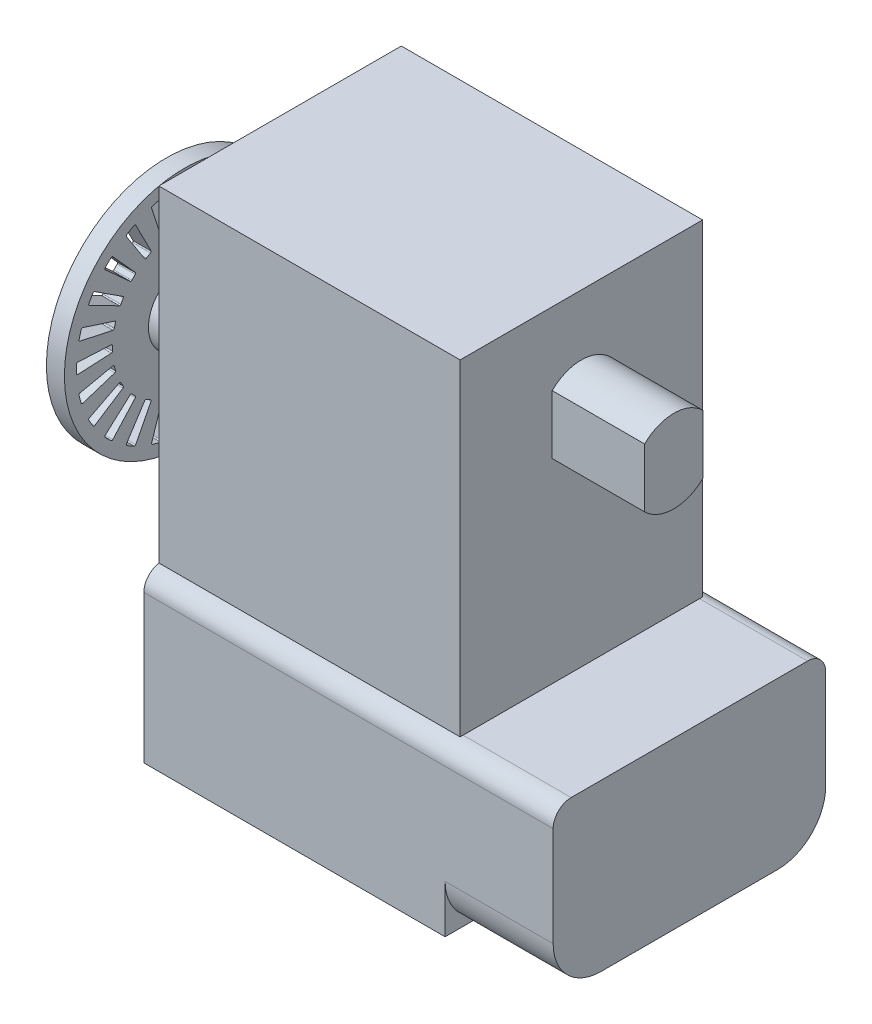
from build123d import *

# Parameters (mm, degrees)
ESQUISSE1_W                  = 25.1
ESQUISSE1_H                  = 27.2
EXTRUSION1_DEPTH             = 20.2
EXTRUSION2_DEPTH             = 25.1
EXTRUSION3_DEPTH             = 9
EXTRUSION4_DEPTH             = 7.7
ESQUISSE6_R                  = 1.25
EXTRUSION5_DEPTH             = 10
ENL_V_MAT_EXTRU_1_REACH      = 57.662
R_P_TITION_CIRCULAIRE1_COUNT = 24


with BuildPart() as part:
    # Esquisse1 → Extrusion1 (new body)
    with BuildSketch(Plane.XY):
        with Locations((12.55, 13.6)):
            Rectangle(ESQUISSE1_W, ESQUISSE1_H)
    extrude(amount=EXTRUSION1_DEPTH)

    # Esquisse2 → Extrusion2 (add)
    with BuildSketch(Plane.ZY):
        with BuildLine():
            Line((0.25, 0), (19.95, 0))
            ThreePointArc((19.95, 0), (21.010660172, -0.439339828), (21.45, -1.5))
            Line((21.45, -1.5), (21.45, -13.8))
            Line((21.45, -13.8), (-1.25, -13.8))
            Line((-1.25, -13.8), (-1.25, -1.5))
            ThreePointArc((-1.25, -1.5), (-0.810660172, -0.439339828), (0.25, 0))
        make_face()
    extrude(amount=-EXTRUSION2_DEPTH)

    # Esquisse4 → Extrusion3 (add)
    with BuildSketch(Plane(origin=(25.1, 0, 0), x_dir=(0, 0, -1), z_dir=(1, 0, 0))):
        with BuildLine():
            Line((1.25, -9.8), (1.25, -1.5))
            ThreePointArc((1.25, -1.5), (0.810660172, -0.439339828), (-0.25, 0))
            Line((-0.25, 0), (-19.95, 0))
            ThreePointArc((-19.95, 0), (-21.010660172, -0.439339828), (-21.45, -1.5))
            Line((-21.45, -1.5), (-21.45, -9.8))
            ThreePointArc((-21.45, -9.8), (-20.278427125, -12.628427125), (-17.45, -13.8))
            Line((-17.45, -13.8), (-2.75, -13.8))
            ThreePointArc((-2.75, -13.8), (0.078427125, -12.628427125), (1.25, -9.8))
        make_face()
    extrude(amount=EXTRUSION3_DEPTH)

    # Esquisse5 → Extrusion4 (add)
    with BuildSketch(Plane(origin=(25.1, 0, 0), x_dir=(0, 0, -1), z_dir=(1, 0, 0))):
        with BuildLine():
            Line((-12.52899156, 21.15), (-12.52899156, 16.25))
            ThreePointArc((-12.52899156, 16.25), (-10.1, 15.25), (-7.67100844, 16.25))
            Line((-7.67100844, 16.25), (-7.67100844, 21.15))
            ThreePointArc((-7.67100844, 21.15), (-10.1, 22.15), (-12.52899156, 21.15))
        make_face()
    extrude(amount=EXTRUSION4_DEPTH)

    # Esquisse6 → Extrusion5 (add)
    with BuildSketch(Plane.ZY):
        with Locations(Location((10.1, 9.45, 0), (0, 0, 180))):
            Circle(ESQUISSE6_R)
    extrude(amount=EXTRUSION5_DEPTH)

    # Esquisse7 → Révolution1 (revolve)
    with BuildSketch(Plane.XY.offset(10.1), mode=Mode.PRIVATE) as r_volution1_sk:
        Polygon((-9.47, 10.7), (-9.47, 19.45), (-7.97, 19.45), (-7.97, 12.45), (-3.47, 12.45), (-3.47, 10.7), align=None)
    revolve(r_volution1_sk.sketch.rotate(Axis((0, 9.45, 10.1), (-1, 0, 0)), 90), axis=Axis((0, 9.45, 10.1), (-1, 0, 0)))

    # Esquisse8 → Enlèv. mat.-Extru.1 (cut, up to next)
    with BuildSketch(Plane.ZY.offset(9.47), mode=Mode.PRIVATE) as enl_v_mat_extru_1_sk1:
        with BuildLine():
            Line((9.796978978, 15.541549664), (9.65509852, 18.338242893))
            ThreePointArc((9.65509852, 18.338242893), (9.681168123, 18.410787455), (9.751093343, 18.443234354))
            ThreePointArc((9.751093343, 18.443234354), (10.1, 18.45), (10.448906657, 18.443234354))
            ThreePointArc((10.448906657, 18.443234354), (10.518831877, 18.410787455), (10.54490148, 18.338242893))
            Line((10.54490148, 18.338242893), (10.403021022, 15.541549664))
            ThreePointArc((10.403021022, 15.541549664), (10.370828899, 15.472999091), (10.299819139, 15.44667177))
            ThreePointArc((10.299819139, 15.44667177), (10.1, 15.45), (9.900180861, 15.44667177))
            ThreePointArc((9.900180861, 15.44667177), (9.829171101, 15.472999091), (9.796978978, 15.541549664))
        make_face()
    enl_v_mat_extru_1_tool1 = extrude(enl_v_mat_extru_1_sk1.sketch, amount=-ENL_V_MAT_EXTRU_1_REACH, mode=Mode.PRIVATE) & part.part
    enl_v_mat_extru_1 = enl_v_mat_extru_1_tool1.solids().sort_by_distance((-9.47, 17.048727, 10.1))[0]
    add(enl_v_mat_extru_1, mode=Mode.SUBTRACT)

    # Répétition circulaire1: Enlèv. mat.-Extru.1 ×24 about axis
    r_p_tition_circulaire1_axis = Axis((0, 9.45, 10.1), (1, 0, 0))
    for i in range(1, R_P_TITION_CIRCULAIRE1_COUNT):
        add(enl_v_mat_extru_1.rotate(r_p_tition_circulaire1_axis, i * 360 / R_P_TITION_CIRCULAIRE1_COUNT), mode=Mode.SUBTRACT)


solid = part.part
